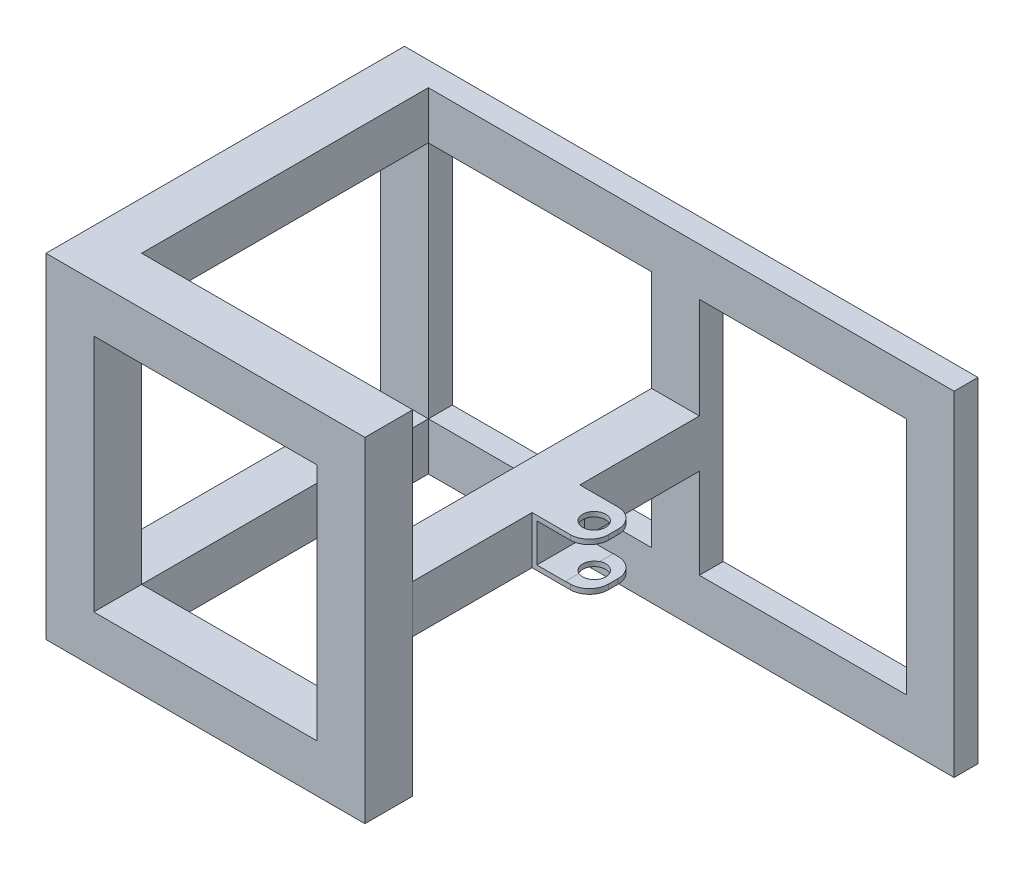
from build123d import *

# Parameters (mm, degrees)
SKETCH1_W            = 600
SKETCH1_H            = 350
SKETCH1_W_2          = 500
SKETCH1_H_2          = 250
BOSS_EXTRUDE1_DEPTH  = 25
SKETCH2_W            = 50
SKETCH2_H            = 50
BOSS_EXTRUDE2_DEPTH  = 350
SKETCH6_W            = 50
SKETCH6_H            = 25
BOSS_EXTRUDE5_DEPTH  = 300
SKETCH7_W            = 50
SKETCH7_H            = 50
BOSS_EXTRUDE6_DEPTH  = 300
SKETCH8_W            = 50
SKETCH8_H            = 50
BOSS_EXTRUDE7_DEPTH  = 50
SKETCH9_W            = 333.649864746
SKETCH9_H            = 350
SKETCH9_W_2          = 233.483328298
SKETCH9_H_2          = 250
BOSS_EXTRUDE8_DEPTH  = 50
SKETCH10_W           = 50
SKETCH10_H           = 50
BOSS_EXTRUDE10_DEPTH = 10
BOSS_EXTRUDE13_DEPTH = 50
SKETCH15_W           = 30
SKETCH15_H           = 40
CUT_EXTRUDE1_DEPTH   = 50
SKETCH16_R           = 12
CUT_EXTRUDE2_DEPTH   = 50
SKETCH17_W           = 49.023713481
SKETCH17_H           = 36.523713481
CUT_EXTRUDE3_DEPTH   = 100
SKETCH18_W           = 57.595301864
SKETCH18_H           = 39.795828349
CUT_EXTRUDE4_DEPTH   = 100


with BuildPart() as part:
    # Sketch1 → Boss-Extrude1 (new body)
    with BuildSketch(Plane.XY):
        with Locations((250, 125)):
            Rectangle(SKETCH1_W, SKETCH1_H)
        with Locations((250, 125)):
            Rectangle(SKETCH1_W_2, SKETCH1_H_2, mode=Mode.SUBTRACT)
    extrude(amount=BOSS_EXTRUDE1_DEPTH)

    # Sketch2 → Boss-Extrude2 (add)
    with BuildSketch(Plane.XY.offset(25)):
        with Locations((-25, 275)):
            Rectangle(SKETCH2_W, SKETCH2_H)
        with Locations((-25, -25)):
            Rectangle(SKETCH2_W, SKETCH2_H)
    extrude(amount=BOSS_EXTRUDE2_DEPTH)

    # Sketch6 → Boss-Extrude5 (add)
    with BuildSketch(Plane.XZ.offset(-250)):
        with Locations((258.483328298, 12.5)):
            Rectangle(SKETCH6_W, SKETCH6_H)
    extrude(amount=BOSS_EXTRUDE5_DEPTH)

    # Sketch7 → Boss-Extrude6 (add)
    with BuildSketch(Plane.XY.offset(25)):
        with Locations((258.483328298, 119.33659126)):
            Rectangle(SKETCH7_W, SKETCH7_H)
    extrude(amount=BOSS_EXTRUDE6_DEPTH)

    # Sketch8 → Boss-Extrude7 (add)
    with BuildSketch(Plane.XY.offset(325)):
        with Locations((258.483328298, 119.33659126)):
            Rectangle(SKETCH8_W, SKETCH8_H)
    extrude(amount=BOSS_EXTRUDE7_DEPTH)

    # Sketch9 → Boss-Extrude8 (add)
    with BuildSketch(Plane.XY.offset(375)):
        with Locations((116.824932373, 125)):
            Rectangle(SKETCH9_W, SKETCH9_H)
        with Locations((116.741664149, 125)):
            Rectangle(SKETCH9_W_2, SKETCH9_H_2, mode=Mode.SUBTRACT)
    extrude(amount=-BOSS_EXTRUDE8_DEPTH)

    # Sketch10 → Boss-Extrude10 (add)
    with BuildSketch(Plane(origin=(283.483328298, 0, 0), x_dir=(0, 0, -1), z_dir=(1, 0, 0))):
        with Locations((-175, 119.33659126)):
            Rectangle(SKETCH10_W, SKETCH10_H)
    extrude(amount=BOSS_EXTRUDE10_DEPTH)

    # Sketch12 → Boss-Extrude13 (add)
    with BuildSketch(Plane.XZ.offset(-94.33659126)):
        with BuildLine():
            Line((293.483328298, 150), (323.483328298, 150))
            ThreePointArc((323.483328298, 150), (337.625463922, 155.857864376), (343.483328298, 170))
            Line((343.483328298, 170), (343.483328298, 180))
            ThreePointArc((343.483328298, 180), (337.625463922, 194.142135624), (323.483328298, 200))
            Line((323.483328298, 200), (293.483328298, 200))
            Line((293.483328298, 200), (293.483328298, 150))
        make_face()
    extrude(amount=-BOSS_EXTRUDE13_DEPTH)

    # Sketch15 → Cut-Extrude1 (cut)
    with BuildSketch(Plane.XY.offset(200)):
        with Locations((303.483328298, 119.33659126)):
            Rectangle(SKETCH15_W, SKETCH15_H)
    extrude(amount=-CUT_EXTRUDE1_DEPTH, mode=Mode.SUBTRACT)

    # Sketch16 → Cut-Extrude2 (cut)
    with BuildSketch(Plane.XZ.offset(-94.33659126)):
        with Locations(Location((323.483328298, 175, 0), (0, 0, 270))):
            Circle(SKETCH16_R)
    extrude(amount=-CUT_EXTRUDE2_DEPTH, mode=Mode.SUBTRACT)

    # Sketch17 → Cut-Extrude3 (cut)
    with BuildSketch(Plane(origin=(288.483328298, 0, 0), x_dir=(0, 0, -1), z_dir=(1, 0, 0))):
        with Locations((-175.48814326, 119.782326646)):
            Rectangle(SKETCH17_W, SKETCH17_H)
    extrude(amount=CUT_EXTRUDE3_DEPTH, mode=Mode.SUBTRACT)

    # Sketch18 → Cut-Extrude4 (cut)
    with BuildSketch(Plane.XY.offset(200)):
        with Locations((317.28097923, 119.438677086)):
            Rectangle(SKETCH18_W, SKETCH18_H)
    extrude(amount=-CUT_EXTRUDE4_DEPTH, mode=Mode.SUBTRACT)


solid = part.part
